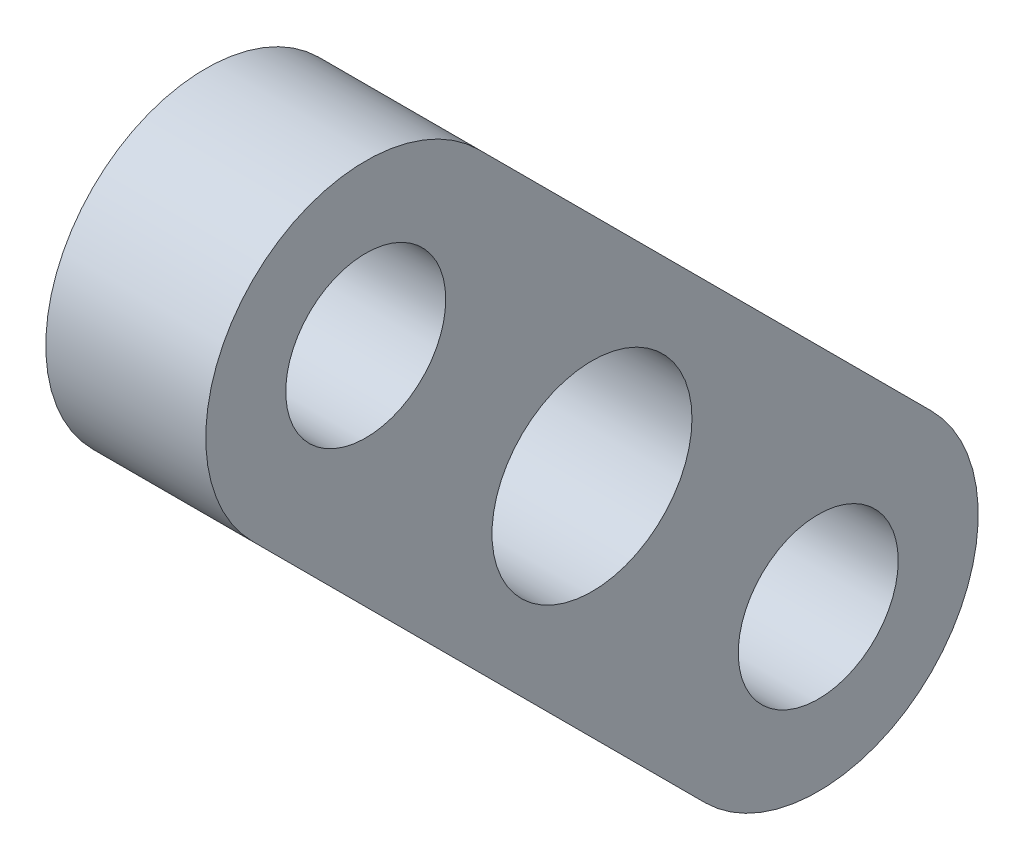
from build123d import *

# Parameters (mm, degrees)
SKETCH1_R           = 1
SKETCH1_R_2         = 1.25
BOSS_EXTRUDE1_DEPTH = 2


with BuildPart() as part:
    # Sketch1 → Boss-Extrude1 (new body)
    with BuildSketch(Plane(origin=(0, 0, 0), x_dir=(0, 0, -1), z_dir=(1, 0, 0))):
        with BuildLine():
            ThreePointArc((-1.414213562, 4.242640687), (-4.242640687, 4.242640687), (-4.242640687, 1.414213562))
            Line((-4.242640687, 1.414213562), (1.414213562, -4.242640687))
            ThreePointArc((1.414213562, -4.242640687), (4.242640687, -4.242640687), (4.242640687, -1.414213562))
            Line((4.242640687, -1.414213562), (-1.414213562, 4.242640687))
        make_face()
        with Locations((2.828427125, -2.828427125)):
            Circle(SKETCH1_R, mode=Mode.SUBTRACT)
        with Locations((-2.828427125, 2.828427125)):
            Circle(SKETCH1_R, mode=Mode.SUBTRACT)
        Circle(SKETCH1_R_2, mode=Mode.SUBTRACT)
    extrude(amount=BOSS_EXTRUDE1_DEPTH)


solid = part.part
